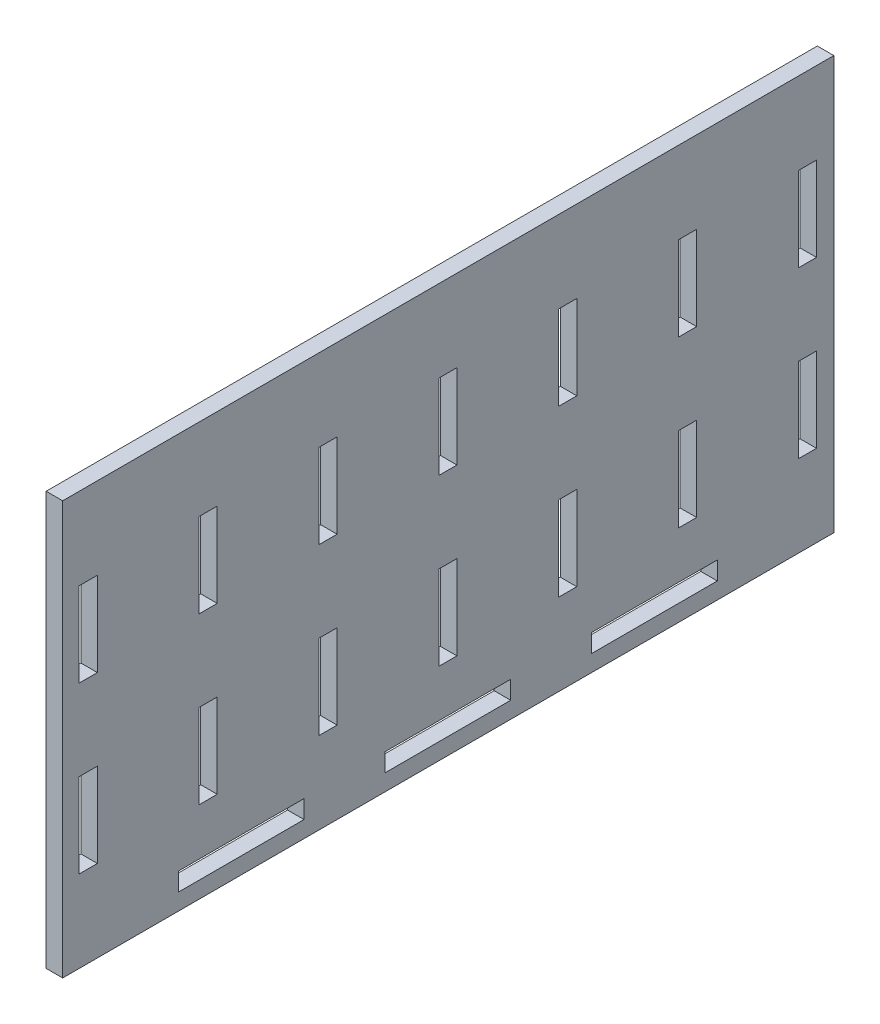
from build123d import *

# Parameters (mm, degrees)
SKETCH_1_W      = 186.6
SKETCH_1_H      = 100
SKETCH_1_W_2    = 4.4
SKETCH_1_H_2    = 20.4
SKETCH_1_W_3    = 30.4
SKETCH_1_H_3    = 4.4
EXTRUDE_1_DEPTH = 4


with BuildPart() as part:
    # Эскиз1 → Бобышка-Вытянуть1 (new body)
    with BuildSketch(Plane(origin=(0, 0, 0), x_dir=(0, 0, -1), z_dir=(1, 0, 0))):
        with Locations((93.3, 50)):
            Rectangle(SKETCH_1_W, SKETCH_1_H)
        with Locations((6.2, 30)):
            Rectangle(SKETCH_1_W_2, SKETCH_1_H_2, mode=Mode.SUBTRACT)
        with Locations((6.2, 70)):
            Rectangle(SKETCH_1_W_2, SKETCH_1_H_2, mode=Mode.SUBTRACT)
        with Locations((35.2, 70)):
            Rectangle(SKETCH_1_W_2, SKETCH_1_H_2, mode=Mode.SUBTRACT)
        with Locations((35.2, 30)):
            Rectangle(SKETCH_1_W_2, SKETCH_1_H_2, mode=Mode.SUBTRACT)
        with Locations((64.2, 70)):
            Rectangle(SKETCH_1_W_2, SKETCH_1_H_2, mode=Mode.SUBTRACT)
        with Locations((64.2, 30)):
            Rectangle(SKETCH_1_W_2, SKETCH_1_H_2, mode=Mode.SUBTRACT)
        with Locations((93.2, 70)):
            Rectangle(SKETCH_1_W_2, SKETCH_1_H_2, mode=Mode.SUBTRACT)
        with Locations((93.2, 30)):
            Rectangle(SKETCH_1_W_2, SKETCH_1_H_2, mode=Mode.SUBTRACT)
        with Locations((122.2, 70)):
            Rectangle(SKETCH_1_W_2, SKETCH_1_H_2, mode=Mode.SUBTRACT)
        with Locations((122.2, 30)):
            Rectangle(SKETCH_1_W_2, SKETCH_1_H_2, mode=Mode.SUBTRACT)
        with Locations((151.2, 70)):
            Rectangle(SKETCH_1_W_2, SKETCH_1_H_2, mode=Mode.SUBTRACT)
        with Locations((151.2, 30)):
            Rectangle(SKETCH_1_W_2, SKETCH_1_H_2, mode=Mode.SUBTRACT)
        with Locations((180.2, 70)):
            Rectangle(SKETCH_1_W_2, SKETCH_1_H_2, mode=Mode.SUBTRACT)
        with Locations((180.2, 30)):
            Rectangle(SKETCH_1_W_2, SKETCH_1_H_2, mode=Mode.SUBTRACT)
        with Locations((43.2, 6.2)):
            Rectangle(SKETCH_1_W_3, SKETCH_1_H_3, mode=Mode.SUBTRACT)
        with Locations((93.2, 6.2)):
            Rectangle(SKETCH_1_W_3, SKETCH_1_H_3, mode=Mode.SUBTRACT)
        with Locations((143.2, 6.2)):
            Rectangle(SKETCH_1_W_3, SKETCH_1_H_3, mode=Mode.SUBTRACT)
    extrude(amount=EXTRUDE_1_DEPTH)


solid = part.part
